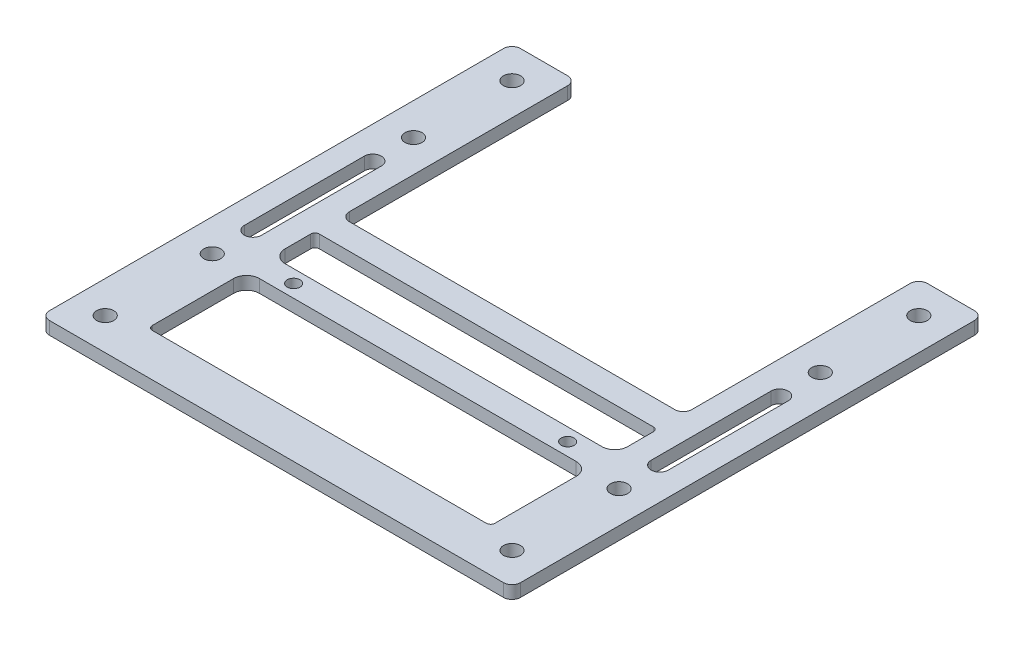
from build123d import *

# Parameters (mm, degrees)
SKETCH_1_R          = 2
SKETCH_1_R_2        = 1.5
EXTRUDE_1_DEPTH     = 3
SKETCH_2_W          = 80
SKETCH_2_H          = 23
SKETCH_2_H_2        = 10
CUT_EXTRUDE_1_DEPTH = 124.020323524
FILLET_1_R          = 2
FILLET_2_R          = 3
FILLET_3_R          = 1


with BuildPart() as part:
    # 草图1 → 凸台-拉伸1 (new body)
    with BuildSketch(Plane(origin=(0, 0, 0), x_dir=(1, 0, 0), z_dir=(0, 1, 0))):
        Polygon((55, 110), (55, 0), (-55, 0), (-55, 110), (-40, 110), (-40, 55), (40, 55), (40, 110), align=None)
        with Locations(Location((47.5, 32.5, 0), (0, 0, 270))):
            Circle(SKETCH_1_R, mode=Mode.SUBTRACT)
        with Locations(Location((47.5, 7.5, 0), (0, 0, 270))):
            Circle(SKETCH_1_R, mode=Mode.SUBTRACT)
        with Locations(Location((47.5, 79.5, 0), (0, 0, 270))):
            Circle(SKETCH_1_R, mode=Mode.SUBTRACT)
        with Locations(Location((47.5, 102.5, 0), (0, 0, 270))):
            Circle(SKETCH_1_R, mode=Mode.SUBTRACT)
        with Locations(Location((-47.5, 102.5, 0), (0, 0, 90))):
            Circle(SKETCH_1_R, mode=Mode.SUBTRACT)
        with Locations(Location((-47.5, 79.5, 0), (0, 0, 90))):
            Circle(SKETCH_1_R, mode=Mode.SUBTRACT)
        with Locations(Location((-47.5, 7.5, 0), (0, 0, 90))):
            Circle(SKETCH_1_R, mode=Mode.SUBTRACT)
        with Locations(Location((-47.5, 32.5, 0), (0, 0, 90))):
            Circle(SKETCH_1_R, mode=Mode.SUBTRACT)
        with Locations(Location((-32, 36, 0), (0, 0, 270))):
            Circle(SKETCH_1_R_2, mode=Mode.SUBTRACT)
        with Locations(Location((32, 36, 0), (0, 0, 90))):
            Circle(SKETCH_1_R_2, mode=Mode.SUBTRACT)
    extrude(amount=EXTRUDE_1_DEPTH)

    # 草图2 → 切除-拉伸1 (cut, through all)
    with BuildSketch(Plane(origin=(0, 3, 0), x_dir=(1, 0, 0), z_dir=(0, 1, 0))):
        with Locations((0, 21.5)):
            Rectangle(SKETCH_2_W, SKETCH_2_H)
        with Locations((0, 44)):
            Rectangle(SKETCH_2_W, SKETCH_2_H_2)
        with BuildLine():
            Line((-45.5, 70), (-45.5, 42))
            ThreePointArc((-45.5, 42), (-47.5, 40), (-49.5, 42))
            Line((-49.5, 42), (-49.5, 70))
            ThreePointArc((-49.5, 70), (-47.5, 72), (-45.5, 70))
        make_face()
        with BuildLine():
            Line((45.5, 70), (45.5, 42))
            ThreePointArc((45.5, 42), (47.5, 40), (49.5, 42))
            Line((49.5, 42), (49.5, 70))
            ThreePointArc((49.5, 70), (47.5, 72), (45.5, 70))
        make_face()
    extrude(amount=-CUT_EXTRUDE_1_DEPTH, mode=Mode.SUBTRACT)

    # 圆角1
    fillet_1_edges = [part.edges().sort_by_distance(p)[0] for p in [
        (55, 1.5, -110),
        (55, 1.5, 0),
        (-55, 1.5, 0),
        (-55, 1.5, -110),
        (-40, 1.5, -110),
        (-40, 1.5, -55),
        (40, 1.5, -55),
        (40, 1.5, -110),
    ]]
    fillet(fillet_1_edges, radius=FILLET_1_R)

    # 圆角2
    fillet_2_edges = [part.edges().sort_by_distance(p)[0] for p in [
        (-40, 1.5, -33),
        (40, 1.5, -33),
        (40, 1.5, -39),
        (-40, 1.5, -39),
    ]]
    fillet(fillet_2_edges, radius=FILLET_2_R)

    # 圆角3
    fillet_3_edges = [part.edges().sort_by_distance(p)[0] for p in [
        (-40, 1.5, -10),
        (40, 1.5, -10),
        (-40, 1.5, -49),
        (40, 1.5, -49),
    ]]
    fillet(fillet_3_edges, radius=FILLET_3_R)


solid = part.part
